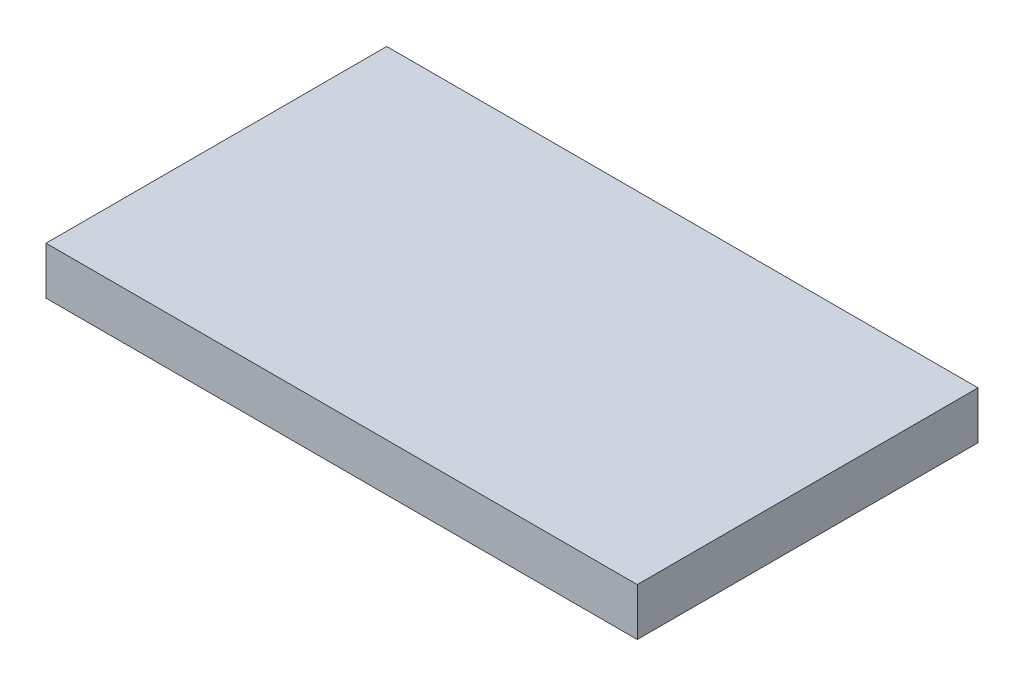
from build123d import *

# Parameters (mm, degrees)
SKETCH1_W           = 118
SKETCH1_H           = 68
BOSS_EXTRUDE1_DEPTH = 9.5


with BuildPart() as part:
    # Sketch1 → Boss-Extrude1 (new body)
    with BuildSketch(Plane(origin=(0, 0, 0), x_dir=(1, 0, 0), z_dir=(0, 1, 0))):
        with Locations((-59, 34)):
            Rectangle(SKETCH1_W, SKETCH1_H)
    extrude(amount=BOSS_EXTRUDE1_DEPTH)


solid = part.part
